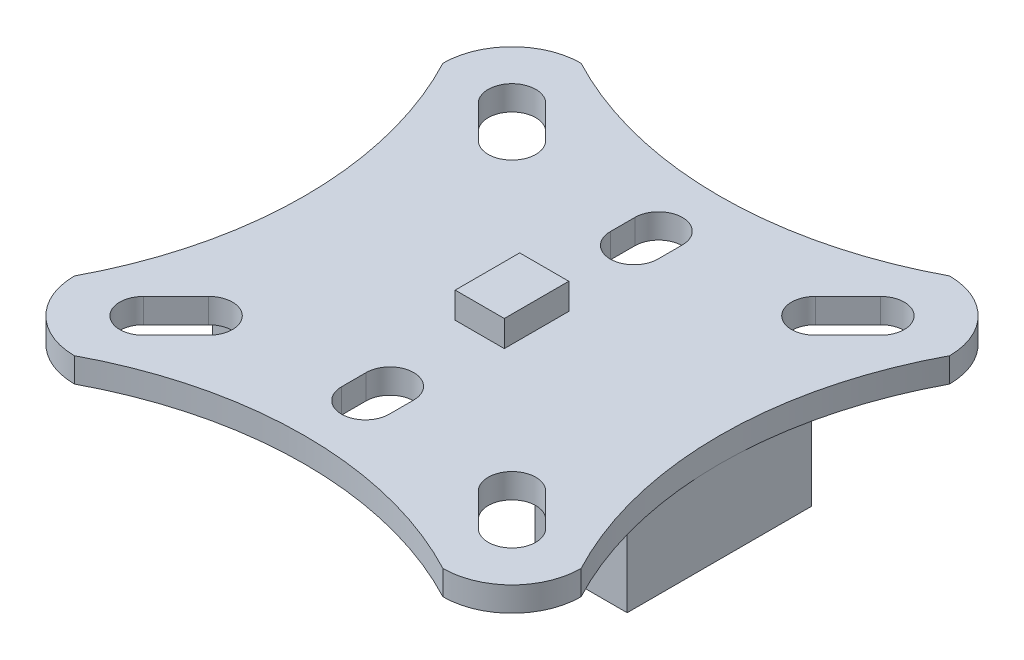
from build123d import *

# Parameters (mm, degrees)
BOSS_EXTRUDE1_DEPTH = 1.6
SKETCH2_W           = 3.2
SKETCH2_H           = 4.2
BOSS_EXTRUDE2_DEPTH = 1.7
SKETCH3_W           = 6
SKETCH3_H           = 12
BOSS_EXTRUDE3_DEPTH = 5.4


with BuildPart() as part:
    # Sketch1 → Boss-Extrude1 (new body)
    with BuildSketch(Plane(origin=(0, 0, 0), x_dir=(1, 0, 0), z_dir=(0, 1, 0))):
        with BuildLine():
            ThreePointArc((0, 4.5), (1.318019485, 1.318019485), (4.5, 0))
            ThreePointArc((4.5, 0), (16.5, 2.98672956), (28.5, 0))
            ThreePointArc((28.5, 0), (31.681980515, 1.318019485), (33, 4.5))
            ThreePointArc((33, 4.5), (30.01327044, 16.5), (33, 28.5))
            ThreePointArc((33, 28.5), (31.681980515, 31.681980515), (28.5, 33))
            ThreePointArc((28.5, 33), (16.5, 30.01327044), (4.5, 33))
            ThreePointArc((4.5, 33), (1.318019485, 31.681980515), (0, 28.5))
            ThreePointArc((0, 28.5), (2.98672956, 16.5), (0, 4.5))
        make_face()
        with BuildLine():
            Line((18.05, 26.05), (18.05, 24.45))
            ThreePointArc((18.05, 24.45), (16.5, 22.9), (14.95, 24.45))
            Line((14.95, 24.45), (14.95, 26.05))
            ThreePointArc((14.95, 26.05), (16.5, 27.6), (18.05, 26.05))
        make_face(mode=Mode.SUBTRACT)
        with BuildLine():
            Line((3.403984489, 5.596015511), (5.525304833, 7.717335854))
            ThreePointArc((5.525304833, 7.717335854), (7.717335854, 7.717335854), (7.717335854, 5.525304833))
            Line((7.717335854, 5.525304833), (5.596015511, 3.403984489))
            ThreePointArc((5.596015511, 3.403984489), (3.403984489, 3.403984489), (3.403984489, 5.596015511))
        make_face(mode=Mode.SUBTRACT)
        with BuildLine():
            Line((29.596015511, 5.596015511), (27.474695167, 7.717335854))
            ThreePointArc((27.474695167, 7.717335854), (25.282664146, 7.717335854), (25.282664146, 5.525304833))
            Line((25.282664146, 5.525304833), (27.403984489, 3.403984489))
            ThreePointArc((27.403984489, 3.403984489), (29.596015511, 3.403984489), (29.596015511, 5.596015511))
        make_face(mode=Mode.SUBTRACT)
        with BuildLine():
            Line((18.05, 6.95), (18.05, 8.55))
            ThreePointArc((18.05, 8.55), (16.5, 10.1), (14.95, 8.55))
            Line((14.95, 8.55), (14.95, 6.95))
            ThreePointArc((14.95, 6.95), (16.5, 5.4), (18.05, 6.95))
        make_face(mode=Mode.SUBTRACT)
        with BuildLine():
            Line((5.596015511, 29.596015511), (7.717335854, 27.474695167))
            ThreePointArc((7.717335854, 27.474695167), (7.717335854, 25.282664146), (5.525304833, 25.282664146))
            Line((5.525304833, 25.282664146), (3.403984489, 27.403984489))
            ThreePointArc((3.403984489, 27.403984489), (3.403984489, 29.596015511), (5.596015511, 29.596015511))
        make_face(mode=Mode.SUBTRACT)
        with BuildLine():
            Line((25.282664146, 27.474695167), (27.403984489, 29.596015511))
            ThreePointArc((27.403984489, 29.596015511), (29.596015511, 29.596015511), (29.596015511, 27.403984489))
            Line((29.596015511, 27.403984489), (27.474695167, 25.282664146))
            ThreePointArc((27.474695167, 25.282664146), (25.282664146, 25.282664146), (25.282664146, 27.474695167))
        make_face(mode=Mode.SUBTRACT)
    extrude(amount=BOSS_EXTRUDE1_DEPTH)

    # Sketch2 → Boss-Extrude2 (add)
    with BuildSketch(Plane(origin=(0, 1.6, 0), x_dir=(1, 0, 0), z_dir=(0, 1, 0))):
        with Locations((16.5, 16.5)):
            Rectangle(SKETCH2_W, SKETCH2_H)
    extrude(amount=BOSS_EXTRUDE2_DEPTH)

    # Sketch3 → Boss-Extrude3 (add)
    with BuildSketch(Plane.XZ):
        with Locations((6, -16.5)):
            Rectangle(SKETCH3_W, SKETCH3_H)
        with Locations((27, -16.5)):
            Rectangle(SKETCH3_W, SKETCH3_H)
    extrude(amount=BOSS_EXTRUDE3_DEPTH)


solid = part.part
